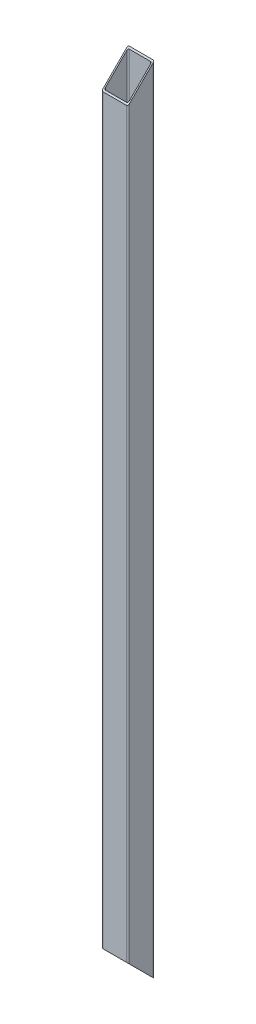
from build123d import *

# Parameters (mm, degrees)
DODANIE_WYCI_GNI_CIE1_DEPTH = 1810
SZKIC2_W                    = 172.684782789
SZKIC2_H                    = 104.540186521
WYTNIJ_WYCI_GNI_CIE1_DEPTH  = 1324.650255921
SZKIC3_W                    = 177.628833627
SZKIC3_H                    = 120.563010223
WYTNIJ_WYCI_GNI_CIE2_DEPTH  = 1782.263596439


with BuildPart() as part:
    # Szkic1 → Dodanie-wyciągnięcie1 (new body)
    with BuildSketch(Plane(origin=(0, 0, 0), x_dir=(1, 0, 0), z_dir=(0, 1, 0))):
        with BuildLine():
            ThreePointArc((0, 57), (0.878679656, 59.121320344), (3, 60))
            Line((3, 60), (57, 60))
            ThreePointArc((57, 60), (59.121320344, 59.121320344), (60, 57))
            Line((60, 57), (60, 3))
            ThreePointArc((60, 3), (59.121320344, 0.878679656), (57, 0))
            Line((57, 0), (3, 0))
            ThreePointArc((3, 0), (0.878679656, 0.878679656), (0, 3))
            Line((0, 3), (0, 57))
        make_face()
        with BuildLine():
            Line((3, 6), (3, 54))
            ThreePointArc((3, 54), (3.878679656, 56.121320344), (6, 57))
            Line((6, 57), (54, 57))
            ThreePointArc((54, 57), (56.121320344, 56.121320344), (57, 54))
            Line((57, 54), (57, 6))
            ThreePointArc((57, 6), (56.121320344, 3.878679656), (54, 3))
            Line((54, 3), (6, 3))
            ThreePointArc((6, 3), (3.878679656, 3.878679656), (3, 6))
        make_face(mode=Mode.SUBTRACT)
    extrude(amount=DODANIE_WYCI_GNI_CIE1_DEPTH)

    # Szkic2 → Wytnij-wyciągnięcie1 (cut, through all)
    with BuildSketch(Plane(origin=(0, 875, 875), x_dir=(1, 0, 0), z_dir=(0, 0.7071067811865464, 0.7071067811865488))):
        with Locations((31.260805739, 1283.757898566)):
            Rectangle(SZKIC2_W, SZKIC2_H)
    extrude(amount=WYTNIJ_WYCI_GNI_CIE1_DEPTH, mode=Mode.SUBTRACT)

    # Szkic3 → Wytnij-wyciągnięcie2 (cut, through all)
    with BuildSketch(Plane(origin=(0, 30, -30), x_dir=(1, 0, 0), z_dir=(0, -0.7071067811865464, 0.7071067811865488))):
        with Locations((21.62509475, 2.040675712)):
            Rectangle(SZKIC3_W, SZKIC3_H)
    extrude(amount=WYTNIJ_WYCI_GNI_CIE2_DEPTH, mode=Mode.SUBTRACT)


solid = part.part
